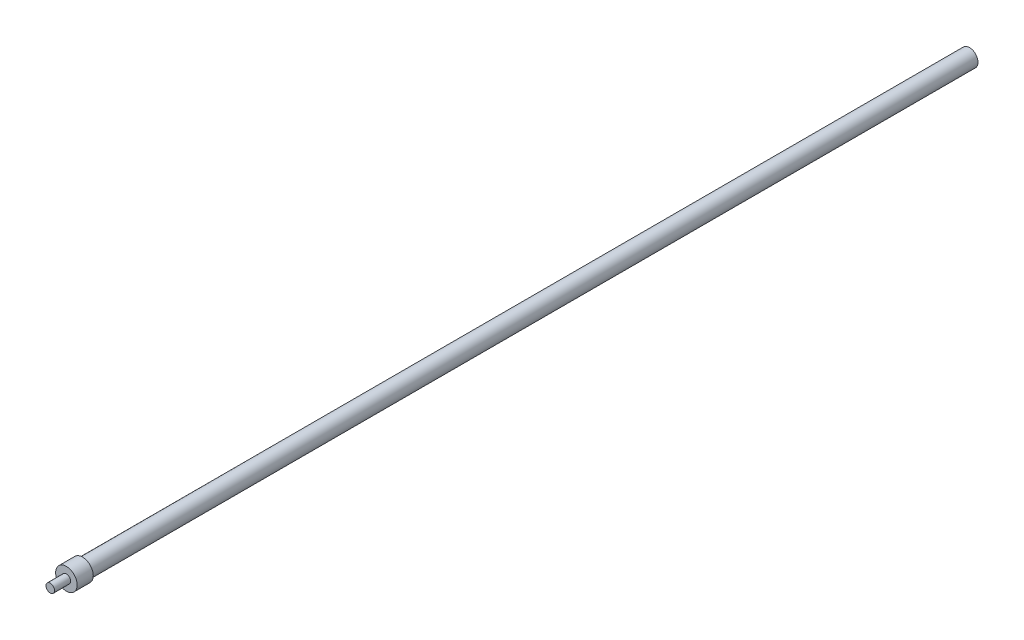
from build123d import *

# Parameters (mm, degrees)
CROQUIS1_R              = 6.35
SALIENTE_EXTRUIR1_DEPTH = 660
CROQUIS4_R              = 8
SALIENTE_EXTRUIR2_DEPTH = 12
CROQUIS5_R              = 3.175
SALIENTE_EXTRUIR3_DEPTH = 12


with BuildPart() as part:
    # Croquis1 → Saliente-Extruir1 (new body)
    with BuildSketch(Plane.XY):
        Circle(CROQUIS1_R)
    extrude(amount=SALIENTE_EXTRUIR1_DEPTH)

    # Croquis4 → Saliente-Extruir2 (add)
    with BuildSketch(Plane.XY.offset(660)):
        Circle(CROQUIS4_R)
    extrude(amount=SALIENTE_EXTRUIR2_DEPTH)

    # Croquis5 → Saliente-Extruir3 (add)
    with BuildSketch(Plane.XY.offset(672)):
        Circle(CROQUIS5_R)
    extrude(amount=SALIENTE_EXTRUIR3_DEPTH)


solid = part.part
